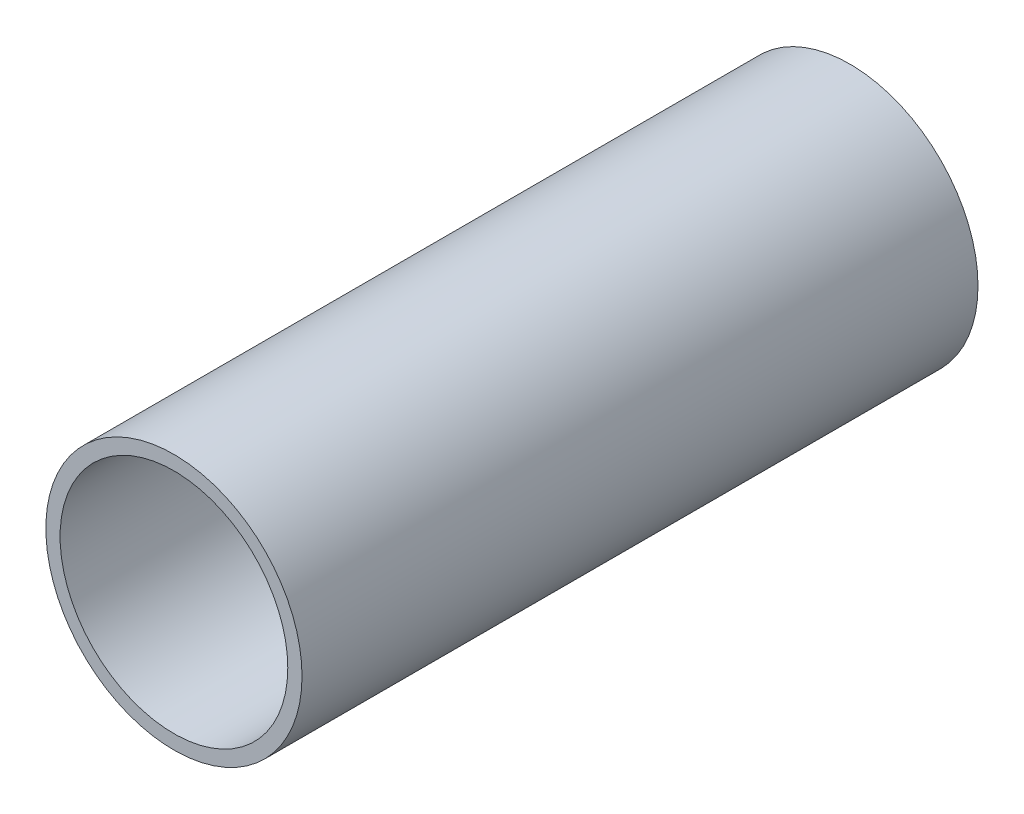
from build123d import *

# Parameters (mm, degrees)
SKETCH1_R           = 57.15
SKETCH1_R_2         = 50.8
BOSS_EXTRUDE1_DEPTH = 150.8125


with BuildPart() as part:
    # Sketch1 → Boss-Extrude1 (new, symmetric)
    with BuildSketch(Plane.XY):
        Circle(SKETCH1_R)
        Circle(SKETCH1_R_2, mode=Mode.SUBTRACT)
    extrude(amount=BOSS_EXTRUDE1_DEPTH, both=True)


solid = part.part
